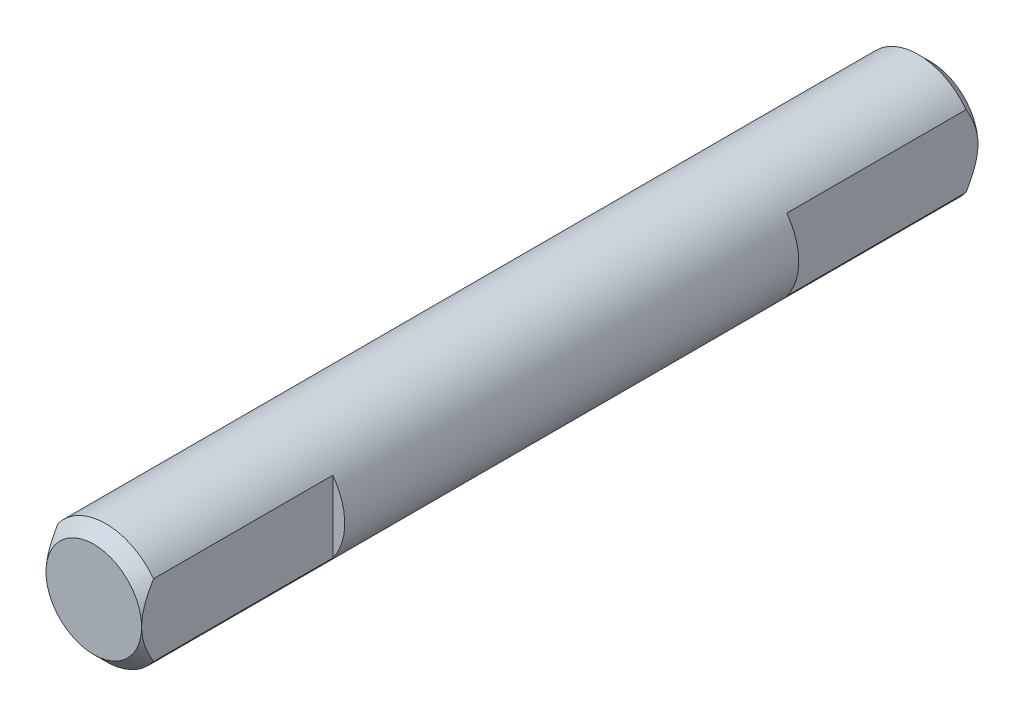
from build123d import *

# Parameters (mm, degrees)
SKETCH1_R           = 2.5
BOSS_EXTRUDE1_DEPTH = 35
CHAMFER1_SIZE       = 0.5
CUT_EXTRUDE1_DEPTH  = 8


with BuildPart() as part:
    # Sketch1 → Boss-Extrude1 (new body)
    with BuildSketch(Plane.XY):
        Circle(SKETCH1_R)
    extrude(amount=BOSS_EXTRUDE1_DEPTH)

    # Chamfer1
    chamfer1_edges = [part.edges().sort_by_distance(p)[0] for p in [
        (-2.5, 0, 0),
        (-2.5, 0, 35),
    ]]
    chamfer(chamfer1_edges, length=CHAMFER1_SIZE)

    # Sketch2 → Cut-Extrude1 (cut)
    with BuildSketch(Plane.XY.offset(35)):
        Polygon((2, 1.555738269), (2, -1.555738269), (4.460999641, -1.695481282), (5.219104654, -0.46598868), (5.068266404, 0.170018194), (3.416674172, 1.653087335), (3.034604396, 1.88867152), align=None)
        Polygon((-2, 1.555738269), (-2, -1.555738269), (-2.968976112, -3.127221032), (-3.471634936, -2.94714388), (-4.717205701, -1.861261674), (-4.943269872, 1.439275222), align=None)
    cut_extrude1 = extrude(amount=-CUT_EXTRUDE1_DEPTH, mode=Mode.SUBTRACT)

    # Mirror1: Cut-Extrude1 across plane
    add(cut_extrude1.mirror(Plane.XY.offset(17.5)), mode=Mode.SUBTRACT)


solid = part.part
